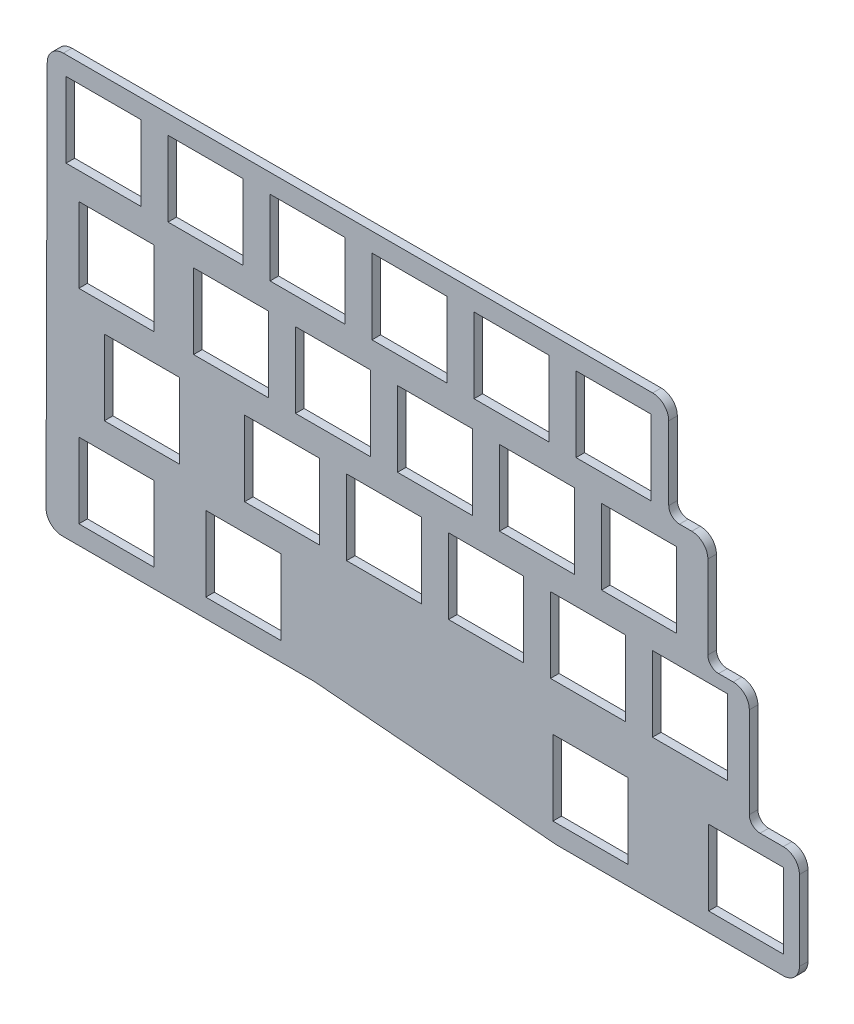
from build123d import *

# Parameters (mm, degrees)
SKETCH1_R           = 1.5
SKETCH1_W           = 14
SKETCH1_H           = 14
BOSS_EXTRUDE1_DEPTH = 1.6
CUT_EXTRUDE1_DEPTH  = 1.6
FILLET1_R           = 3
SKETCH3_W           = 5.928661094
SKETCH3_H           = 12.435728147
SKETCH3_W_2         = 5.350255133
SKETCH3_H_2         = 5.928661094
SKETCH3_W_3         = 5.639458113
SKETCH3_W_4         = 6.651668543
SKETCH3_H_3         = 7.446976739
SKETCH3_W_5         = 5.928661093
SKETCH3_H_4         = 5.784059603
SKETCH3_H_5         = 4.627247683
BOSS_EXTRUDE2_DEPTH = 1.6
CUT_EXTRUDE2_DEPTH  = 95.202490958
FILLET2_R           = 3
CUT_EXTRUDE3_DEPTH  = 95.202490958
FILLET3_R           = 3
FILLET4_R           = 3
FILLET7_R           = 2


with BuildPart() as part:
    # Sketch1 → Boss-Extrude1 (new body)
    with BuildSketch(Plane.XY):
        with BuildLine():
            Line((69.256483633, 39.154946315), (-80.703110167, 39.058787515))
            ThreePointArc((-80.703110167, 39.058787515), (-82.819785745, 38.18282616), (-83.701171171, 36.068403419))
            Line((-83.701171171, 36.068403419), (-83.931946571, -35.933513481))
            ThreePointArc((-83.931946571, -35.933513481), (-83.056679124, -38.061046878), (-80.931961975, -38.943128786))
            Line((-80.931961975, -38.943128786), (-34.162352475, -38.943128786))
            ThreePointArc((-34.162352475, -38.943128786), (-34.036703471, -38.945761219), (-33.911274976, -38.953653901))
            Line((-33.911274976, -38.953653901), (11.083089424, -42.732603701))
            ThreePointArc((11.083089424, -42.732603701), (11.20851792, -42.740496382), (11.334166924, -42.743128815))
            Line((11.334166924, -42.743128815), (59.596129524, -42.743128815))
            ThreePointArc((59.596129524, -42.743128815), (61.35026035, -42.176855395), (62.442179406, -40.69181219))
            Line((62.442179406, -40.69181219), (72.104457106, -11.70497919))
            ThreePointArc((72.104457106, -11.70497919), (72.219669608, -11.236842575), (72.258407243, -10.756295796))
            Line((72.258407243, -10.756295796), (72.258407243, 36.154946904))
            ThreePointArc((72.258407243, 36.154946904), (71.379047386, 38.276947252), (69.256483633, 39.154946315))
        make_face()
        with Locations((35.108407229, 34.256871219)):
            Circle(SKETCH1_R, mode=Mode.SUBTRACT)
        with Locations((-28.161592771, -22.743128781)):
            Circle(SKETCH1_R, mode=Mode.SUBTRACT)
        with Locations((-1.491592771, -27.493128781)):
            Circle(SKETCH1_R, mode=Mode.SUBTRACT)
        with Locations((-79.366592771, -9.443128781)):
            Circle(SKETCH1_R, mode=Mode.SUBTRACT)
        with Locations((49.358407229, -9.443128781)):
            Circle(SKETCH1_R, mode=Mode.SUBTRACT)
        with Locations((-59.891592771, 17.156871219)):
            Circle(SKETCH1_R, mode=Mode.SUBTRACT)
        with Locations((2.808407229, 28.556871219)):
            Rectangle(SKETCH1_W, SKETCH1_H, mode=Mode.SUBTRACT)
        with Locations((21.808407229, 28.556871219)):
            Rectangle(SKETCH1_W, SKETCH1_H, mode=Mode.SUBTRACT)
        with Locations((-35.191592771, 28.556871219)):
            Rectangle(SKETCH1_W, SKETCH1_H, mode=Mode.SUBTRACT)
        with Locations((-16.191592771, 28.556871219)):
            Rectangle(SKETCH1_W, SKETCH1_H, mode=Mode.SUBTRACT)
        with Locations((-70.816592771, 9.556871219)):
            Rectangle(SKETCH1_W, SKETCH1_H, mode=Mode.SUBTRACT)
        with Locations((-49.441592771, 9.556871219)):
            Rectangle(SKETCH1_W, SKETCH1_H, mode=Mode.SUBTRACT)
        with Locations((-30.441592771, 9.556871219)):
            Rectangle(SKETCH1_W, SKETCH1_H, mode=Mode.SUBTRACT)
        with Locations((-11.441592771, 9.556871219)):
            Rectangle(SKETCH1_W, SKETCH1_H, mode=Mode.SUBTRACT)
        with Locations((-39.941592771, -9.443128781)):
            Rectangle(SKETCH1_W, SKETCH1_H, mode=Mode.SUBTRACT)
        with Locations((-1.941592771, -9.443128781)):
            Rectangle(SKETCH1_W, SKETCH1_H, mode=Mode.SUBTRACT)
        with Locations((26.558407229, 9.556871219)):
            Rectangle(SKETCH1_W, SKETCH1_H, mode=Mode.SUBTRACT)
        with Locations((36.058407229, -9.443128781)):
            Rectangle(SKETCH1_W, SKETCH1_H, mode=Mode.SUBTRACT)
        with Locations((17.508407229, -32.243128781)):
            Rectangle(SKETCH1_W, SKETCH1_H, mode=Mode.SUBTRACT)
        with Locations((-70.816592771, -28.443128781)):
            Rectangle(SKETCH1_W, SKETCH1_H, mode=Mode.SUBTRACT)
        with Locations((-73.191592771, 28.556871219)):
            Rectangle(SKETCH1_W, SKETCH1_H, mode=Mode.SUBTRACT)
        with Locations((-54.191592771, 28.556871219)):
            Rectangle(SKETCH1_W, SKETCH1_H, mode=Mode.SUBTRACT)
        with Locations((7.558407229, 9.556871219)):
            Rectangle(SKETCH1_W, SKETCH1_H, mode=Mode.SUBTRACT)
        with Locations((-66.066592771, -9.443128781)):
            Rectangle(SKETCH1_W, SKETCH1_H, mode=Mode.SUBTRACT)
        with Locations((-20.941592771, -9.443128781)):
            Rectangle(SKETCH1_W, SKETCH1_H, mode=Mode.SUBTRACT)
        with Locations((17.058407229, -9.443128781)):
            Rectangle(SKETCH1_W, SKETCH1_H, mode=Mode.SUBTRACT)
        with Locations((-47.161592771, -28.443128781)):
            Rectangle(SKETCH1_W, SKETCH1_H, mode=Mode.SUBTRACT)
        with Locations((46.508407229, -32.243128781)):
            Rectangle(SKETCH1_W, SKETCH1_H, mode=Mode.SUBTRACT)
    extrude(amount=BOSS_EXTRUDE1_DEPTH)

    # Sketch2 → Cut-Extrude1 (cut)
    with BuildSketch(Plane.XY.offset(1.6)):
        Polygon((39.377336656, 41.971884199), (39.377336656, 0), (47.100744033, 0), (47.100744033, -5.977603272), (56.433194615, -5.977603272), (56.433194615, -45.238257442), (88.453154369, -41.859266714), (93.4411883, 41.971884199), align=None)
    extrude(amount=-CUT_EXTRUDE1_DEPTH, mode=Mode.SUBTRACT)

    # Fillet1
    fillet1_edges = [part.edges().sort_by_distance(p)[0] for p in [
        (56.433194615, -42.743128815, 0.8),
        (39.377336656, 39.135786868, 0.8),
        (56.433194615, -5.977603272, 0.8),
        (47.100744033, 0, 0.8),
    ]]
    fillet(fillet1_edges, radius=FILLET1_R)

    # Sketch3 → Boss-Extrude2 (add, through all)
    with BuildSketch(Plane.XY.offset(1.6)):
        with Locations((-78.603151983, -9.902316574)):
            Rectangle(SKETCH3_W, SKETCH3_H)
        with Locations((-60.094161253, 17.210462816)):
            Rectangle(SKETCH3_W_2, SKETCH3_H_2)
        with Locations((-27.992630455, -23.133352916)):
            Rectangle(SKETCH3_W_3, SKETCH3_H_2)
        with Locations((-1.313655536, -26.856841286)):
            Rectangle(SKETCH3_W_4, SKETCH3_H_3)
        with Locations((49.658369718, -10.480722534)):
            Rectangle(SKETCH3_W_5, SKETCH3_H_4)
        with Locations((35.05361922, 33.911934921)):
            Rectangle(SKETCH3_W_2, SKETCH3_H_5)
    extrude(amount=-BOSS_EXTRUDE2_DEPTH)

    # Sketch4 → Cut-Extrude2 (cut, through all)
    with BuildSketch(Plane.XY.offset(1.6)):
        Polygon((47.100744033, -5.977603272), (47.100744033, -21.90424025), (70.264082054, -21.90424025), (70.264082054, 0), align=None)
    extrude(amount=-CUT_EXTRUDE2_DEPTH, mode=Mode.SUBTRACT)

    # Fillet2
    fillet2_edges = [part.edges().sort_by_distance(p)[0] for p in [
        (56.433194615, -21.90424025, 0.8),
    ]]
    fillet(fillet2_edges, radius=FILLET2_R)

    # Sketch5 → Cut-Extrude3 (cut, through all)
    with BuildSketch(Plane.XY.offset(1.6)):
        Polygon((39.377336656, 20.463996343), (32.089288673, 20.463996343), (32.089288673, 44.034039226), (51.321286853, 44.034039226), align=None)
    extrude(amount=-CUT_EXTRUDE3_DEPTH, mode=Mode.SUBTRACT)

    # Fillet3
    fillet3_edges = [part.edges().sort_by_distance(p)[0] for p in [
        (32.089288673, 39.131113542, 0.8),
    ]]
    fillet(fillet3_edges, radius=FILLET3_R)

    # Fillet4
    fillet4_edges = [part.edges().sort_by_distance(p)[0] for p in [
        (39.377336656, 20.463996343, 0.8),
    ]]
    fillet(fillet4_edges, radius=FILLET4_R)

    # Fillet7
    fillet7_edges = [part.edges().sort_by_distance(p)[0] for p in [
        (39.377336656, 0, 0.8),
        (47.100744033, -21.90424025, 0.8),
        (32.089288673, 20.463996343, 0.8),
    ]]
    fillet(fillet7_edges, radius=FILLET7_R)


solid = part.part
